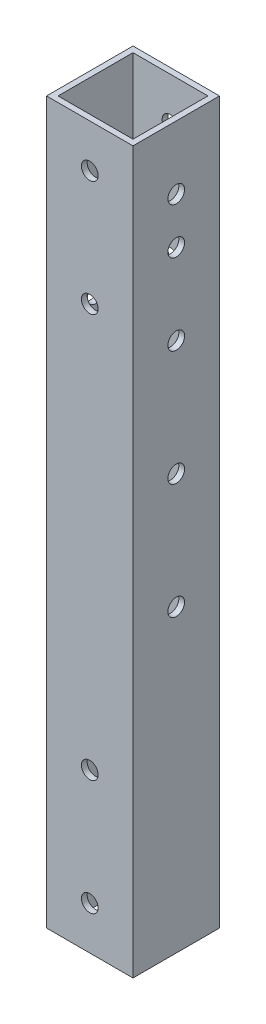
from build123d import *

# Parameters (mm, degrees)
SKETCH_1_W          = 15
SKETCH_1_H          = 15
SKETCH_1_W_2        = 13
SKETCH_1_H_2        = 13
EXTRUDE_1_DEPTH     = 125
SKETCH_2_R          = 1.45
CUT_EXTRUDE_1_DEPTH = 127.119982556
SKETCH_3_R          = 1.45
CUT_EXTRUDE_2_DEPTH = 127.119982556


with BuildPart() as part:
    # 草图1 → 拉伸-薄壁1 (new body)
    with BuildSketch(Plane(origin=(0, 0, 0), x_dir=(1, 0, 0), z_dir=(0, 1, 0))):
        Rectangle(SKETCH_1_W, SKETCH_1_H)
        Rectangle(SKETCH_1_W_2, SKETCH_1_H_2, mode=Mode.SUBTRACT)
    extrude(amount=EXTRUDE_1_DEPTH)

    # 草图2 → 切除-拉伸1 (cut, through all)
    with BuildSketch(Plane.XY.offset(7.5)):
        with Locations((0, 7.5)):
            Circle(SKETCH_2_R)
        with Locations((0, 27.5)):
            Circle(SKETCH_2_R)
        with Locations(Location((0, 97.5, 0), (0, 0, 180))):
            Circle(SKETCH_2_R)
        with Locations(Location((0, 117.5, 0), (0, 0, 180))):
            Circle(SKETCH_2_R)
    extrude(amount=-CUT_EXTRUDE_1_DEPTH, mode=Mode.SUBTRACT)

    # 草图3 → 切除-拉伸2 (cut, through all)
    with BuildSketch(Plane(origin=(7.5, 0, 0), x_dir=(0, 0, -1), z_dir=(1, 0, 0))):
        with Locations((0, 72)):
            Circle(SKETCH_3_R)
        with Locations((0, 92)):
            Circle(SKETCH_3_R)
        with Locations((0, 52)):
            Circle(SKETCH_3_R)
        with Locations((0, 114)):
            Circle(SKETCH_3_R)
        with Locations((0, 106)):
            Circle(SKETCH_3_R)
    extrude(amount=-CUT_EXTRUDE_2_DEPTH, mode=Mode.SUBTRACT)


solid = part.part
